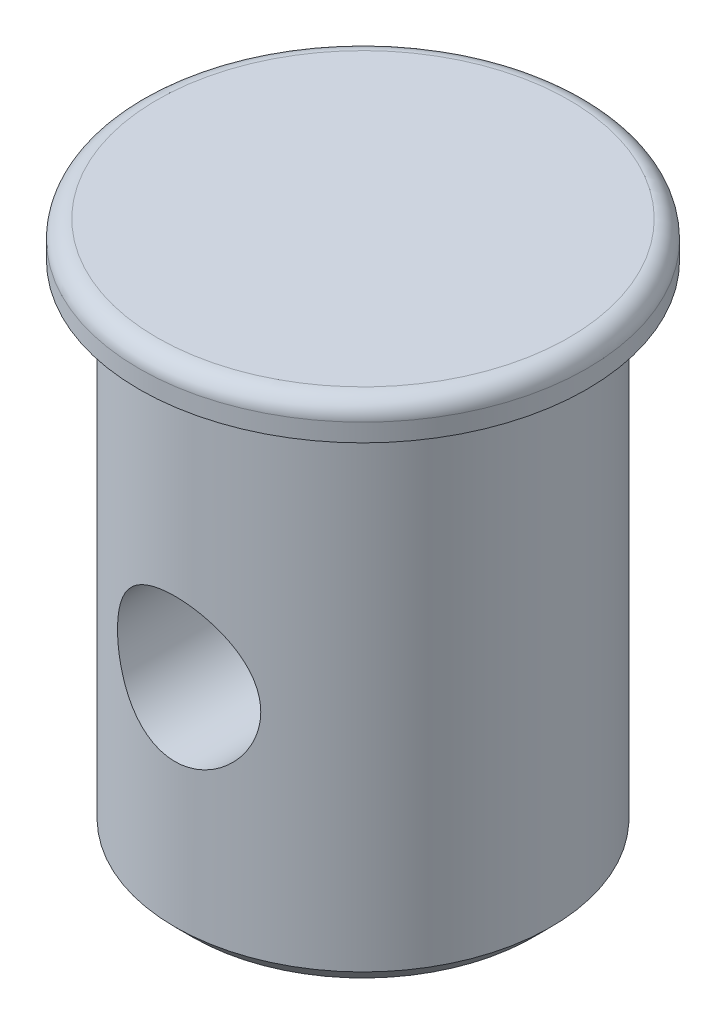
from build123d import *

# Parameters (mm, degrees)
SKETCH_1_R               = 10.5
EXTRUDE_1_DEPTH          = 28
SKETCH_2_R               = 12.5
EXTRUDE_2_DEPTH          = 2
FILLET_1_R               = 1
CHAMFER_1_SIZE           = 1
CUT_EXTRUDE_1_DEPTH      = 35.820970729
CUT_EXTRUDE_1_DEPTH_BACK = 35.820970729
SKETCH_3_R               = 4


with BuildPart() as part:
    # Эскиз1 → Бобышка-Вытянуть1 (new body)
    with BuildSketch(Plane(origin=(0, 0, 0), x_dir=(1, 0, 0), z_dir=(0, 1, 0))):
        with Locations(Location((0, 0, 0), (0, 0, 270))):
            Circle(SKETCH_1_R)
    extrude(amount=EXTRUDE_1_DEPTH)

    # Эскиз2 → Бобышка-Вытянуть2 (add)
    with BuildSketch(Plane(origin=(0, 28, 0), x_dir=(1, 0, 0), z_dir=(0, 1, 0))):
        with Locations(Location((0, 0, 0), (0, 0, 270))):
            Circle(SKETCH_2_R)
    extrude(amount=EXTRUDE_2_DEPTH)

    # Скругление1
    fillet_1_edges = [part.edges().sort_by_distance(p)[0] for p in [
        (0, 30, -12.5),
    ]]
    fillet(fillet_1_edges, radius=FILLET_1_R)

    # Фаска1
    chamfer_1_edges = [part.edges().sort_by_distance(p)[0] for p in [
        (0, 0, -10.5),
    ]]
    chamfer(chamfer_1_edges, length=CHAMFER_1_SIZE)

    # Эскиз3 → Вырез-Вытянуть1 (cut, two sides: drawn at the far end of the back side and taken through both)
    with BuildSketch(Plane.XY.offset(-CUT_EXTRUDE_1_DEPTH_BACK)):
        with Locations(Location((0, 13, 0), (0, 0, 89.999999999))):
            Circle(SKETCH_3_R)
    extrude(amount=CUT_EXTRUDE_1_DEPTH + CUT_EXTRUDE_1_DEPTH_BACK, mode=Mode.SUBTRACT)


solid = part.part
